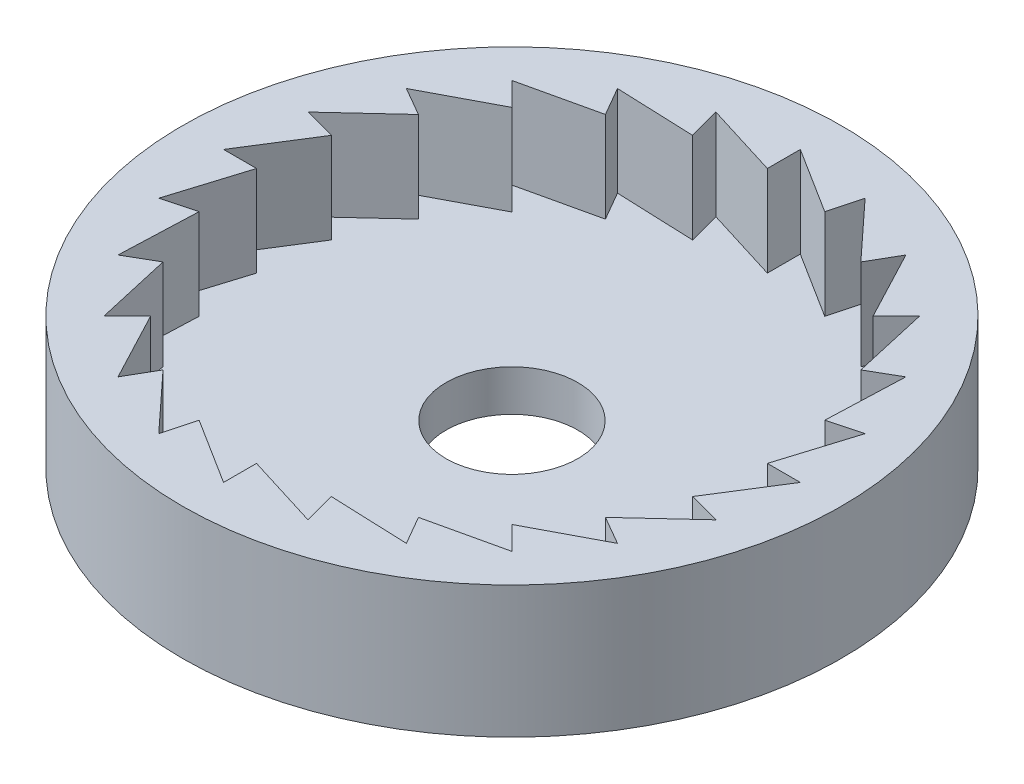
from build123d import *

# Parameters (mm, degrees)
SKETCH1_R           = 20
SKETCH1_R_2         = 17.5
BOSS_EXTRUDE2_DEPTH = 8
SHELL2_T            = -2.5
BOSS_EXTRUDE3_DEPTH = 5.5
SKETCH4_R           = 4
CUT_EXTRUDE1_DEPTH  = 12


with BuildPart() as part:
    # Sketch1 → Boss-Extrude2 (new body)
    # profile 1 of 2: a face of its own
    with BuildSketch(Plane(origin=(0, 0, 0), x_dir=(1, 0, 0), z_dir=(0, 1, 0))):
        with Locations(Location((0, 0, 0), (0, 0, 270))):
            Circle(SKETCH1_R)
        Circle(SKETCH1_R_2, mode=Mode.SUBTRACT)
    # profile 2 of 2: a face of its own
    with BuildSketch(Plane(origin=(0, 0, 0), x_dir=(1, 0, 0), z_dir=(0, 1, 0))):
        Circle(SKETCH1_R_2)
    extrude(amount=BOSS_EXTRUDE2_DEPTH)

    # Shell2
    shell2_openings = [part.faces().sort_by_distance(p)[0] for p in [
        (0, 8, 0),
    ]]
    offset(amount=SHELL2_T, openings=shell2_openings, kind=Kind.INTERSECTION)

    # Sketch3 → Boss-Extrude3 (add)
    with BuildSketch(Plane(origin=(0, 2.5, 0), x_dir=(1, 0, 0), z_dir=(0, 1, 0))):
        with BuildLine():
            Line((-14.971850307, -4.011695199), (-16.90370196, -4.529333289))
            ThreePointArc((-16.90370196, -4.529333289), (-16.167891819, -6.696960066), (-15.155444566, -8.75))
            Line((-15.155444566, -8.75), (-14.971850307, -4.011695199))
        make_face()
        with BuildLine():
            Line((-15.5, 0), (-17.5, 0))
            ThreePointArc((-17.5, 0), (-17.350285074, -2.284208364), (-16.90370196, -4.529333289))
            Line((-16.90370196, -4.529333289), (-15.5, 0))
        make_face()
        with BuildLine():
            Line((-14.971850307, 4.011695199), (-16.90370196, 4.529333289))
            ThreePointArc((-16.90370196, 4.529333289), (-17.350285074, 2.284208364), (-17.5, 0))
            Line((-17.5, 0), (-14.971850307, 4.011695199))
        make_face()
        with BuildLine():
            ThreePointArc((0, 17.5), (-2.284208364, 17.350285074), (-4.529333289, 16.90370196))
            Line((-4.529333289, 16.90370196), (0, 15.5))
            Line((0, 15.5), (0, 17.5))
        make_face()
        with BuildLine():
            ThreePointArc((4.529333289, 16.90370196), (2.284208364, 17.350285074), (0, 17.5))
            Line((0, 17.5), (4.011695199, 14.971850307))
            Line((4.011695199, 14.971850307), (4.529333289, 16.90370196))
        make_face()
        with BuildLine():
            ThreePointArc((8.75, 15.155444566), (6.696960066, 16.167891819), (4.529333289, 16.90370196))
            Line((4.529333289, 16.90370196), (7.75, 13.423393759))
            Line((7.75, 13.423393759), (8.75, 15.155444566))
        make_face()
        with BuildLine():
            ThreePointArc((12.374368671, 12.374368671), (10.653325008, 13.883683455), (8.75, 15.155444566))
            Line((8.75, 15.155444566), (10.960155108, 10.960155108))
            Line((10.960155108, 10.960155108), (12.374368671, 12.374368671))
        make_face()
        with BuildLine():
            ThreePointArc((15.155444566, 8.75), (13.883683455, 10.653325008), (12.374368671, 12.374368671))
            Line((12.374368671, 12.374368671), (13.423393759, 7.75))
            Line((13.423393759, 7.75), (15.155444566, 8.75))
        make_face()
        with BuildLine():
            ThreePointArc((16.90370196, 4.529333289), (16.167891819, 6.696960066), (15.155444566, 8.75))
            Line((15.155444566, 8.75), (14.971850307, 4.011695199))
            Line((14.971850307, 4.011695199), (16.90370196, 4.529333289))
        make_face()
        with BuildLine():
            ThreePointArc((17.5, 0), (17.350285074, 2.284208364), (16.90370196, 4.529333289))
            Line((16.90370196, 4.529333289), (15.5, 0))
            Line((15.5, 0), (17.5, 0))
        make_face()
        with BuildLine():
            ThreePointArc((16.90370196, -4.529333289), (17.350285074, -2.284208364), (17.5, 0))
            Line((17.5, 0), (14.971850307, -4.011695199))
            Line((14.971850307, -4.011695199), (16.90370196, -4.529333289))
        make_face()
        with BuildLine():
            ThreePointArc((15.155444566, -8.75), (16.167891819, -6.696960066), (16.90370196, -4.529333289))
            Line((16.90370196, -4.529333289), (13.423393759, -7.75))
            Line((13.423393759, -7.75), (15.155444566, -8.75))
        make_face()
        with BuildLine():
            ThreePointArc((12.374368671, -12.374368671), (13.883683455, -10.653325008), (15.155444566, -8.75))
            Line((15.155444566, -8.75), (10.960155108, -10.960155108))
            Line((10.960155108, -10.960155108), (12.374368671, -12.374368671))
        make_face()
        with BuildLine():
            ThreePointArc((8.75, -15.155444566), (10.653325008, -13.883683455), (12.374368671, -12.374368671))
            Line((12.374368671, -12.374368671), (7.75, -13.423393759))
            Line((7.75, -13.423393759), (8.75, -15.155444566))
        make_face()
        with BuildLine():
            ThreePointArc((4.529333289, -16.90370196), (6.696960066, -16.167891819), (8.75, -15.155444566))
            Line((8.75, -15.155444566), (4.011695199, -14.971850307))
            Line((4.011695199, -14.971850307), (4.529333289, -16.90370196))
        make_face()
        with BuildLine():
            Line((0, -15.5), (0, -17.5))
            ThreePointArc((0, -17.5), (2.284208364, -17.350285074), (4.529333289, -16.90370196))
            Line((4.529333289, -16.90370196), (0, -15.5))
        make_face()
        with BuildLine():
            Line((-4.011695199, -14.971850307), (-4.529333289, -16.90370196))
            ThreePointArc((-4.529333289, -16.90370196), (-2.284208364, -17.350285074), (0, -17.5))
            Line((0, -17.5), (-4.011695199, -14.971850307))
        make_face()
        with BuildLine():
            Line((-7.75, -13.423393759), (-8.75, -15.155444566))
            ThreePointArc((-8.75, -15.155444566), (-6.696960066, -16.167891819), (-4.529333289, -16.90370196))
            Line((-4.529333289, -16.90370196), (-7.75, -13.423393759))
        make_face()
        with BuildLine():
            Line((-10.960155108, -10.960155108), (-12.374368671, -12.374368671))
            ThreePointArc((-12.374368671, -12.374368671), (-10.653325008, -13.883683455), (-8.75, -15.155444566))
            Line((-8.75, -15.155444566), (-10.960155108, -10.960155108))
        make_face()
        with BuildLine():
            Line((-13.423393759, -7.75), (-15.155444566, -8.75))
            ThreePointArc((-15.155444566, -8.75), (-13.883683455, -10.653325008), (-12.374368671, -12.374368671))
            Line((-12.374368671, -12.374368671), (-13.423393759, -7.75))
        make_face()
        with BuildLine():
            Line((-13.423393759, 7.75), (-15.155444566, 8.75))
            ThreePointArc((-15.155444566, 8.75), (-16.167891819, 6.696960066), (-16.90370196, 4.529333289))
            Line((-16.90370196, 4.529333289), (-13.423393759, 7.75))
        make_face()
        with BuildLine():
            Line((-10.960155108, 10.960155108), (-12.374368671, 12.374368671))
            ThreePointArc((-12.374368671, 12.374368671), (-13.883683455, 10.653325008), (-15.155444566, 8.75))
            Line((-15.155444566, 8.75), (-10.960155108, 10.960155108))
        make_face()
        with BuildLine():
            Line((-7.75, 13.423393759), (-8.75, 15.155444566))
            ThreePointArc((-8.75, 15.155444566), (-10.653325008, 13.883683455), (-12.374368671, 12.374368671))
            Line((-12.374368671, 12.374368671), (-7.75, 13.423393759))
        make_face()
        with BuildLine():
            Line((-4.011695199, 14.971850307), (-4.529333289, 16.90370196))
            ThreePointArc((-4.529333289, 16.90370196), (-6.696960066, 16.167891819), (-8.75, 15.155444566))
            Line((-8.75, 15.155444566), (-4.011695199, 14.971850307))
        make_face()
    extrude(amount=BOSS_EXTRUDE3_DEPTH)

    # Sketch4 → Cut-Extrude1 (cut)
    with BuildSketch(Plane(origin=(0, 2.5, 0), x_dir=(1, 0, 0), z_dir=(0, 1, 0))):
        with Locations(Location((0, 0, 0), (0, 0, 270))):
            Circle(SKETCH4_R)
    extrude(amount=-CUT_EXTRUDE1_DEPTH, mode=Mode.SUBTRACT)


solid = part.part
